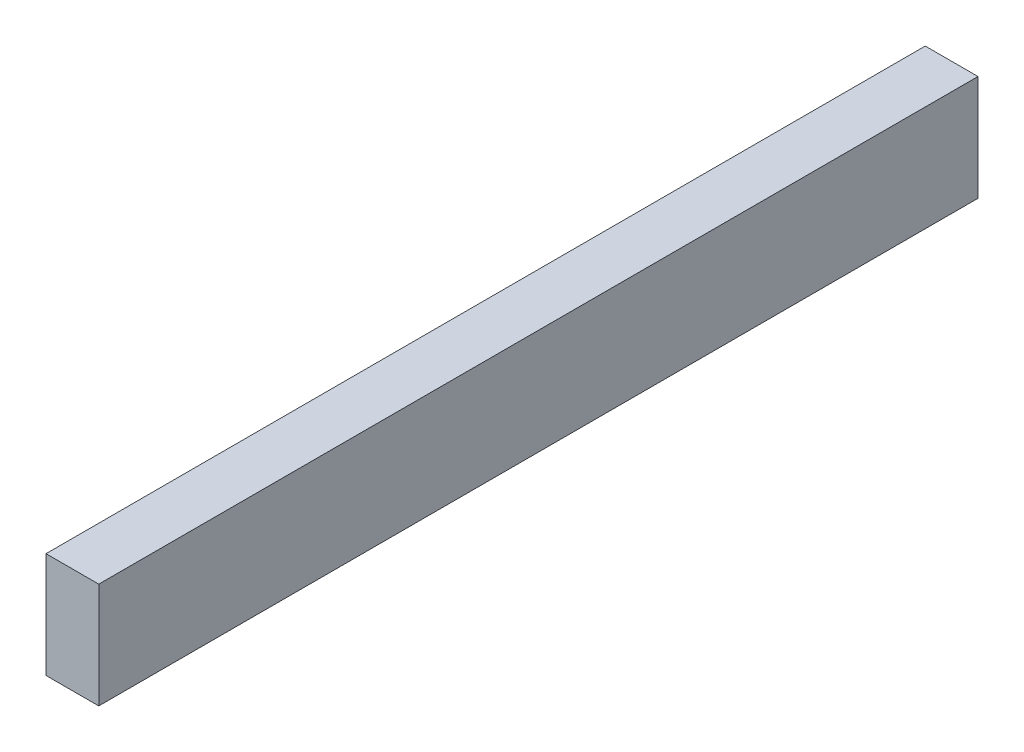
from build123d import *

# Parameters (mm, degrees)
SKETCH1_W           = 30
SKETCH1_H           = 60
BOSS_EXTRUDE1_DEPTH = 250


with BuildPart() as part:
    # Sketch1 → Boss-Extrude1 (new, symmetric)
    with BuildSketch(Plane.XY):
        Rectangle(SKETCH1_W, SKETCH1_H)
    extrude(amount=BOSS_EXTRUDE1_DEPTH, both=True)


solid = part.part
